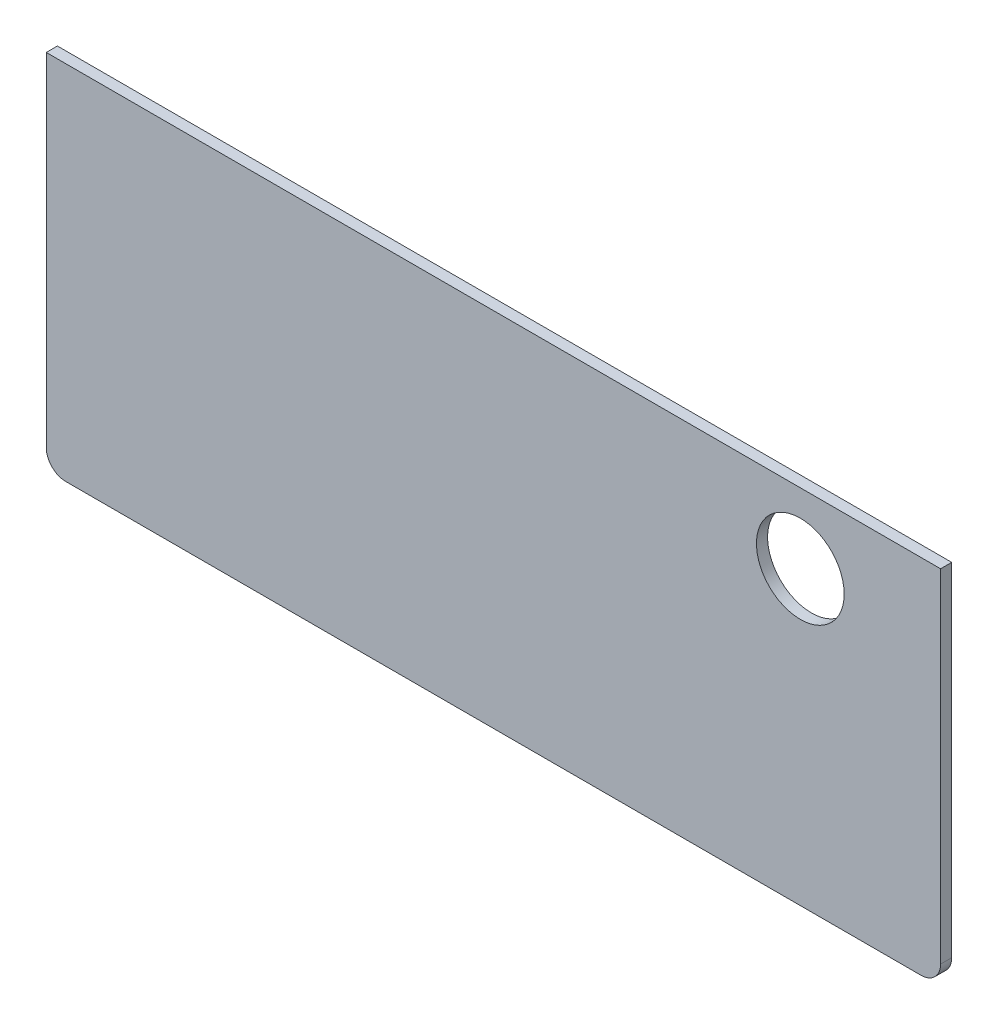
from build123d import *

# Parameters (mm, degrees)
SKETCH1_W           = 255
SKETCH1_H           = 103.175
SKETCH1_R           = 12.5
BOSS_EXTRUDE1_DEPTH = 3.175
FILLET1_R           = 5.55625


with BuildPart() as part:
    # Sketch1 → Boss-Extrude1 (new body)
    with BuildSketch(Plane.XY):
        with Locations((-24.265375854, -24.400711845)):
            Rectangle(SKETCH1_W, SKETCH1_H)
        with Locations((63.234624146, 7.186788155)):
            Circle(SKETCH1_R, mode=Mode.SUBTRACT)
    extrude(amount=BOSS_EXTRUDE1_DEPTH)

    # Fillet1
    fillet1_edges = [part.edges().sort_by_distance(p)[0] for p in [
        (103.234624146, -75.988211845, 1.5875),
        (-151.765375854, -75.988211845, 1.5875),
    ]]
    fillet(fillet1_edges, radius=FILLET1_R)


solid = part.part
